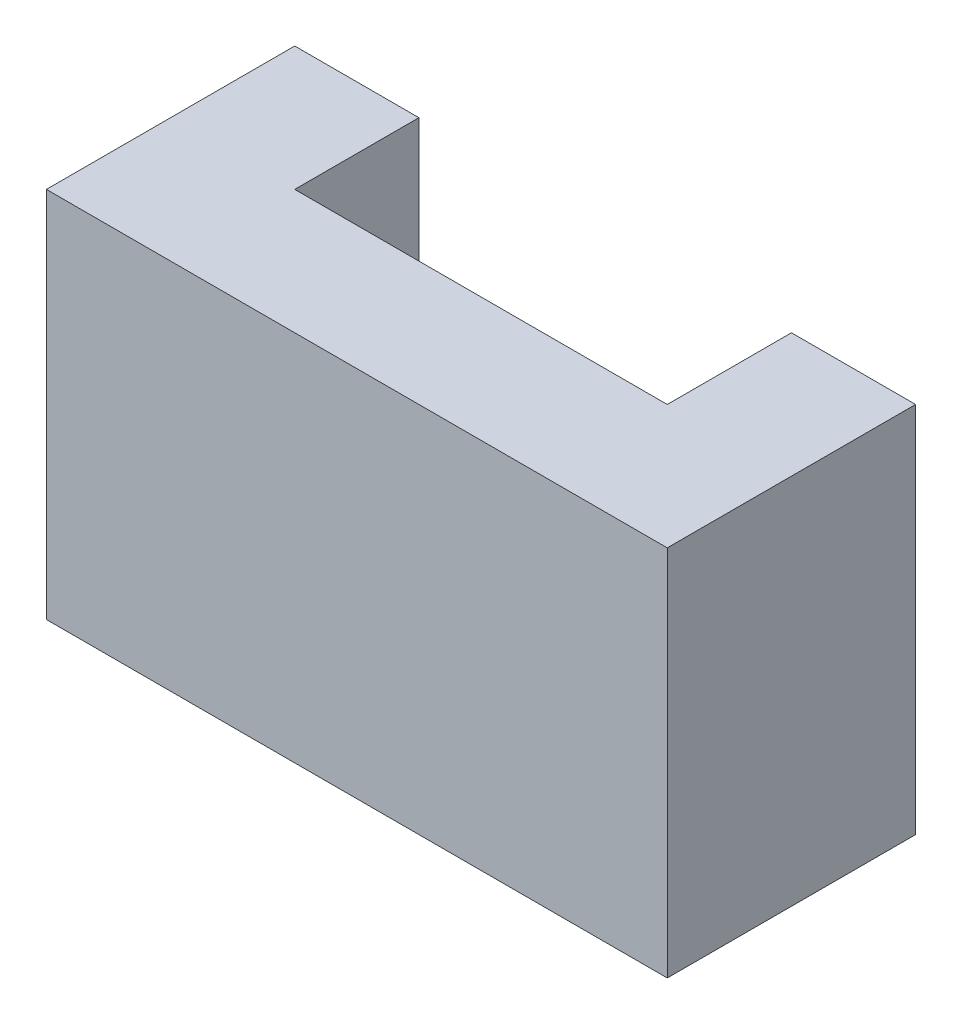
from build123d import *

# Parameters (mm, degrees)
BOSS_EXTRUDE1_DEPTH = 30


with BuildPart() as part:
    # Sketch1 → Boss-Extrude1 (new body)
    with BuildSketch(Plane(origin=(0, 0, 0), x_dir=(1, 0, 0), z_dir=(0, 1, 0))):
        Polygon((-25, 0), (-15, 0), (-15, -10), (15, -10), (15, 0), (25, 0), (25, -20), (-25, -20), align=None)
    extrude(amount=BOSS_EXTRUDE1_DEPTH)


solid = part.part
